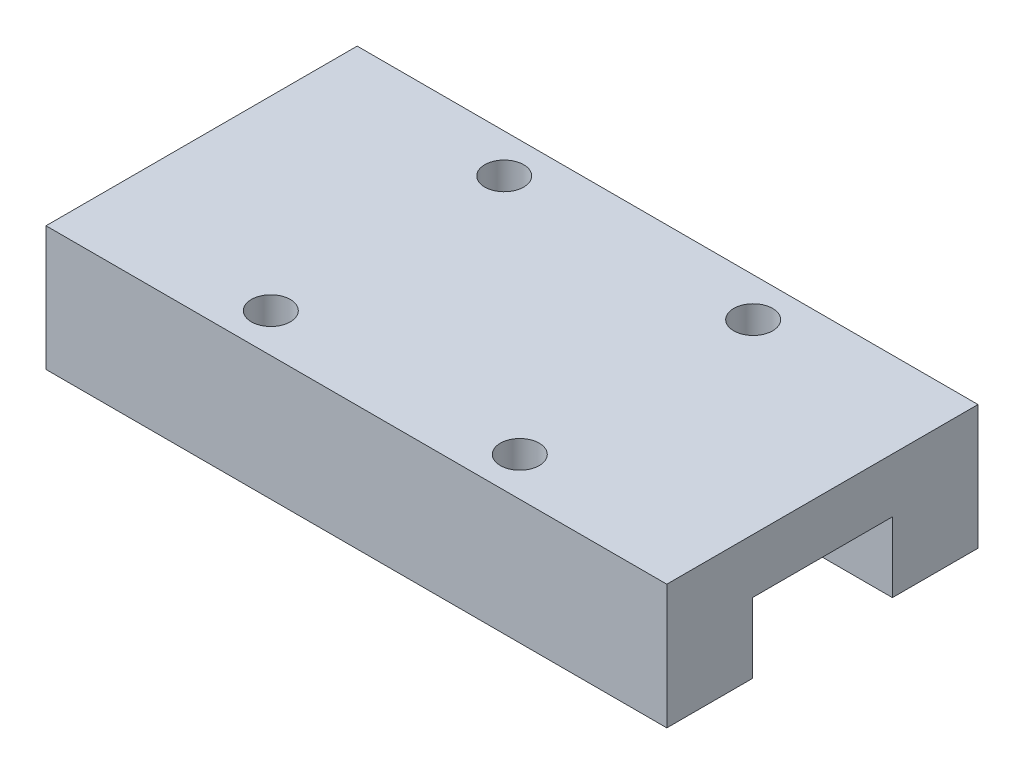
from build123d import *

# Parameters (mm, degrees)
EXTRUDE_1_DEPTH        = 19.95
HOLE_WIZARD_M3_1_D     = 2.5
HOLE_WIZARD_M3_1_DEPTH = 4.5
HOLE_WIZARD_M3_1_TIP   = 0.751075774


with BuildPart() as part:
    # 草图1 → 凸台-拉伸1 (new, symmetric)
    with BuildSketch(Plane(origin=(0, 0, 0), x_dir=(0, 0, -1), z_dir=(1, 0, 0))):
        Polygon((0, 0), (0, 8), (20, 8), (20, 0), (14.5, 0), (14.5, 4.5), (5.5, 4.5), (5.5, 0), align=None)
    extrude(amount=EXTRUDE_1_DEPTH, both=True)

    # M3 螺纹孔1
    with Locations(Plane(origin=(0, 8, 0), x_dir=(1, 0, 0), z_dir=(0, 1, 0))):
        with Locations((-8, 17.5), (8, 17.5), (8, 2.5), (-8, 2.5)):
            Hole(HOLE_WIZARD_M3_1_D / 2, depth=HOLE_WIZARD_M3_1_DEPTH)
            with Locations((0, 0, -(HOLE_WIZARD_M3_1_DEPTH + HOLE_WIZARD_M3_1_TIP / 2))):  # 118° drill point
                Cone(0, HOLE_WIZARD_M3_1_D / 2, HOLE_WIZARD_M3_1_TIP, mode=Mode.SUBTRACT)


solid = part.part
